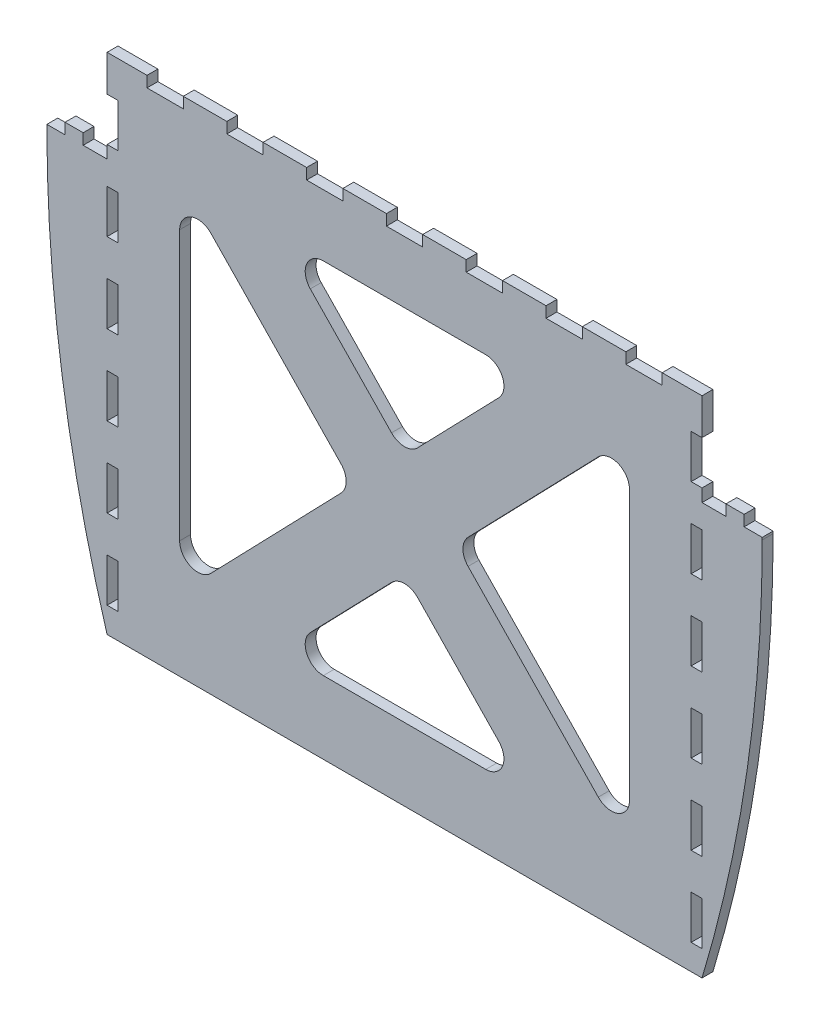
from build123d import *

# Parameters (mm, degrees)
BOSS_EXTRUDE1_DEPTH = 3
SKETCH2_W           = 10
SKETCH2_H           = 3
SKETCH2_W_2         = 3
SKETCH2_H_2         = 12
CUT_EXTRUDE1_DEPTH  = 10


with BuildPart() as part:
    # Sketch1 → Boss-Extrude1 (new body)
    with BuildSketch(Plane.XY.offset(152)):
        with BuildLine():
            Line((-82, 69.5), (82, 69.5))
            Line((82, 69.5), (82, 44))
            Line((82, 44), (88.6, 44))
            Line((88.6, 44), (88.6, 47))
            Line((88.6, 47), (93.6, 47))
            Line((93.6, 47), (93.6, 44))
            Line((93.6, 44), (98.6, 44))
            Line((98.6, 44), (98.6, 43.377104502))
            ThreePointArc((98.6, 43.377104502), (94.427800977, -13.668492876), (82, -69.5))
            Line((82, -69.5), (-82, -69.5))
            ThreePointArc((-82, -69.5), (-94.427800977, -13.668492876), (-98.6, 43.377104502))
            Line((-98.6, 43.377104502), (-98.6, 44))
            Line((-98.6, 44), (-93.6, 44))
            Line((-93.6, 44), (-93.6, 47))
            Line((-93.6, 47), (-88.6, 47))
            Line((-88.6, 47), (-88.6, 44))
            Line((-88.6, 44), (-82, 44))
            Line((-82, 44), (-82, 69.5))
        make_face()
        with BuildLine():
            Line((-62, -37.134656801), (-62, 37.134656801))
            ThreePointArc((-62, 37.134656801), (-58.87434678, 41.770045043), (-53.405270341, 40.609986811))
            Line((-53.405270341, 40.609986811), (-17.504048439, 3.47533001))
            ThreePointArc((-17.504048439, 3.47533001), (-16.098778099, 0), (-17.504048439, -3.47533001))
            Line((-17.504048439, -3.47533001), (-53.405270341, -40.609986811))
            ThreePointArc((-53.405270341, -40.609986811), (-58.87434678, -41.770045043), (-62, -37.134656801))
        make_face(mode=Mode.SUBTRACT)
        with BuildLine():
            Line((22.39294647, 49.5), (-22.39294647, 49.5))
            ThreePointArc((-22.39294647, 49.5), (-26.996024247, 46.452351141), (-25.987676129, 41.02466999))
            Line((-25.987676129, 41.02466999), (-3.594729659, 17.862383642))
            ThreePointArc((-3.594729659, 17.862383642), (0, 16.337713652), (3.594729659, 17.862383642))
            Line((3.594729659, 17.862383642), (25.987676129, 41.02466999))
            ThreePointArc((25.987676129, 41.02466999), (26.996024247, 46.452351141), (22.39294647, 49.5))
        make_face(mode=Mode.SUBTRACT)
        with BuildLine():
            Line((53.405270341, 40.609986811), (17.504048439, 3.47533001))
            ThreePointArc((17.504048439, 3.47533001), (16.098778099, 0), (17.504048439, -3.47533001))
            Line((17.504048439, -3.47533001), (53.405270341, -40.609986811))
            ThreePointArc((53.405270341, -40.609986811), (58.87434678, -41.770045043), (62, -37.134656801))
            Line((62, -37.134656801), (62, 37.134656801))
            ThreePointArc((62, 37.134656801), (58.87434678, 41.770045043), (53.405270341, 40.609986811))
        make_face(mode=Mode.SUBTRACT)
        with BuildLine():
            Line((-25.987676129, -41.02466999), (-3.594729659, -17.862383642))
            ThreePointArc((-3.594729659, -17.862383642), (0, -16.337713652), (3.594729659, -17.862383642))
            Line((3.594729659, -17.862383642), (25.987676129, -41.02466999))
            ThreePointArc((25.987676129, -41.02466999), (26.996024247, -46.452351141), (22.39294647, -49.5))
            Line((22.39294647, -49.5), (-22.39294647, -49.5))
            ThreePointArc((-22.39294647, -49.5), (-26.996024247, -46.452351141), (-25.987676129, -41.02466999))
        make_face(mode=Mode.SUBTRACT)
    extrude(amount=BOSS_EXTRUDE1_DEPTH)

    # Sketch2 → Cut-Extrude1 (cut)
    with BuildSketch(Plane.XY.offset(155)):
        with Locations((0, 68)):
            Rectangle(SKETCH2_W, SKETCH2_H)
        with Locations((-22, 68)):
            Rectangle(SKETCH2_W, SKETCH2_H)
        with Locations((22, 68)):
            Rectangle(SKETCH2_W, SKETCH2_H)
        with Locations((-44, 68)):
            Rectangle(SKETCH2_W, SKETCH2_H)
        with Locations((44, 68)):
            Rectangle(SKETCH2_W, SKETCH2_H)
        with Locations((-66, 68)):
            Rectangle(SKETCH2_W, SKETCH2_H)
        with Locations((66, 68)):
            Rectangle(SKETCH2_W, SKETCH2_H)
        with Locations((-80.5, 53.5)):
            Rectangle(SKETCH2_W_2, SKETCH2_H_2)
        with Locations((80.5, 53.5)):
            Rectangle(SKETCH2_W_2, SKETCH2_H_2)
        with Locations((-80.5, 31.5)):
            Rectangle(SKETCH2_W_2, SKETCH2_H_2)
        with Locations((-80.5, 9.5)):
            Rectangle(SKETCH2_W_2, SKETCH2_H_2)
        with Locations((-80.5, -12.5)):
            Rectangle(SKETCH2_W_2, SKETCH2_H_2)
        with Locations((-80.5, -34.5)):
            Rectangle(SKETCH2_W_2, SKETCH2_H_2)
        with Locations((-80.5, -56.5)):
            Rectangle(SKETCH2_W_2, SKETCH2_H_2)
        with Locations((80.5, -56.5)):
            Rectangle(SKETCH2_W_2, SKETCH2_H_2)
        with Locations((80.5, -34.5)):
            Rectangle(SKETCH2_W_2, SKETCH2_H_2)
        with Locations((80.5, -12.5)):
            Rectangle(SKETCH2_W_2, SKETCH2_H_2)
        with Locations((80.5, 9.5)):
            Rectangle(SKETCH2_W_2, SKETCH2_H_2)
        with Locations((80.5, 31.5)):
            Rectangle(SKETCH2_W_2, SKETCH2_H_2)
    extrude(amount=-CUT_EXTRUDE1_DEPTH, mode=Mode.SUBTRACT)


solid = part.part
